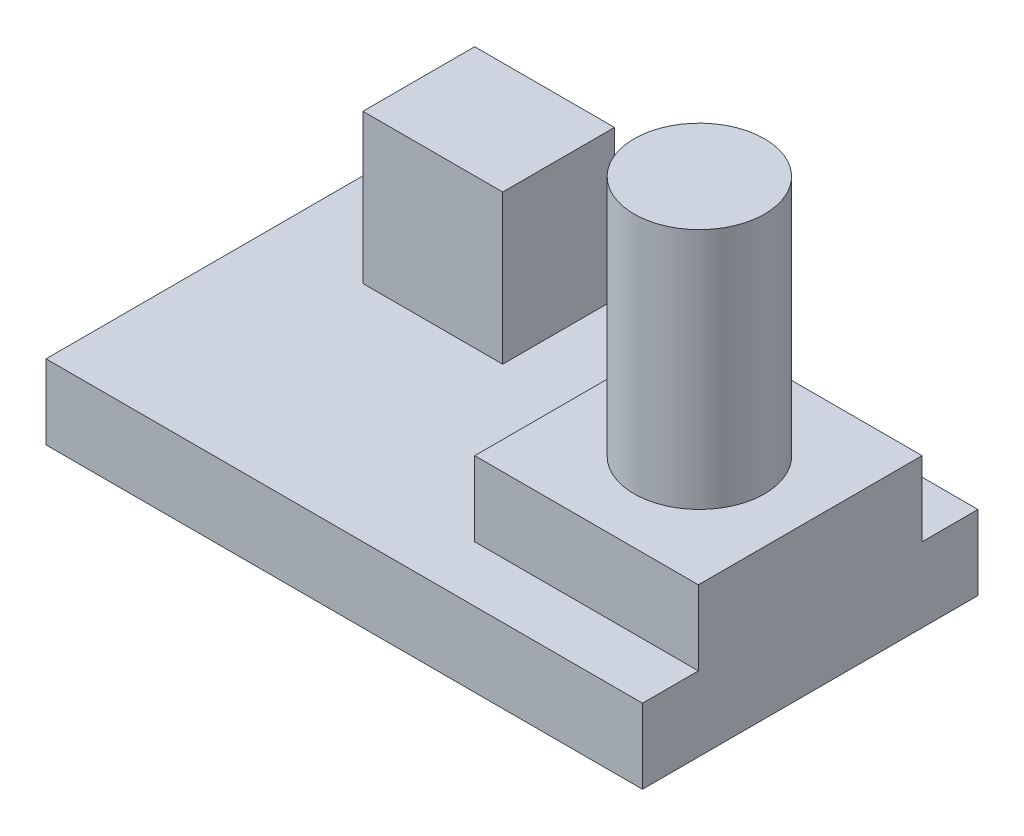
from build123d import *

# Parameters (mm, degrees)
SKETCH1_W           = 32
SKETCH1_H           = 18
PCB_DEPTH           = 4
SKETCH2_W           = 7.5
SKETCH2_H           = 6
CONNECTOR_DEPTH     = 8
SKETCH3_W           = 12
SKETCH3_H           = 12
ENCODER_DEPTH       = 4
SKETCH4_R           = 3.5
BOSS_EXTRUDE4_DEPTH = 13


with BuildPart() as part:
    # Sketch1 → PCB (new body)
    with BuildSketch(Plane(origin=(0, 0, 0), x_dir=(1, 0, 0), z_dir=(0, 1, 0))):
        Rectangle(SKETCH1_W, SKETCH1_H)
    extrude(amount=PCB_DEPTH)

    # Sketch2 → Connector (add)
    with BuildSketch(Plane(origin=(0, 4, 0), x_dir=(1, 0, 0), z_dir=(0, 1, 0))):
        with Locations((-7.25, 6)):
            Rectangle(SKETCH2_W, SKETCH2_H)
    extrude(amount=CONNECTOR_DEPTH)

    # Sketch3 → Encoder (add)
    with BuildSketch(Plane(origin=(0, 4, 0), x_dir=(1, 0, 0), z_dir=(0, 1, 0))):
        with Locations((10, 0)):
            Rectangle(SKETCH3_W, SKETCH3_H)
    extrude(amount=ENCODER_DEPTH)

    # Sketch4 → Boss-Extrude4 (add)
    with BuildSketch(Plane(origin=(0, 8, 0), x_dir=(1, 0, 0), z_dir=(0, 1, 0))):
        with Locations(Location((10.051012923, 0, 0), (0, 0, 90))):
            Circle(SKETCH4_R)
    extrude(amount=BOSS_EXTRUDE4_DEPTH)


solid = part.part
